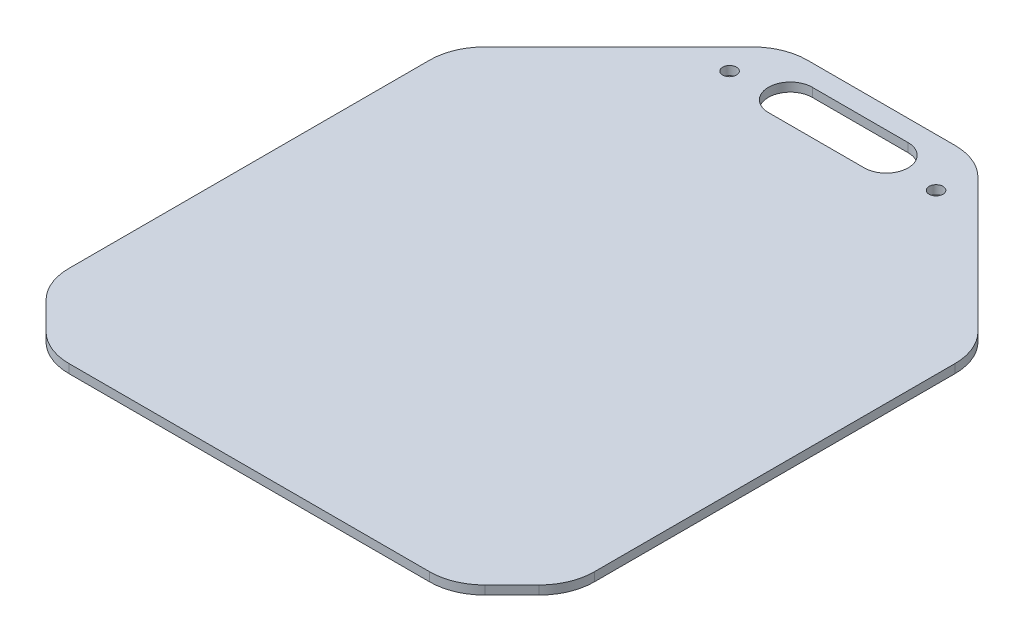
from build123d import *

# Parameters (mm, degrees)
BODY_DEPTH                    = 6.35
HANDLE_DEPTH                  = 6.35
SKETCH11_R                    = 5
LOCKING_MECHANISM_HOLES_DEPTH = 6.36
FILLET1_R                     = 40
FILLET2_R                     = 40
SKETCH12_W                    = 304.8
SKETCH12_H                    = 50.8
BOSS_EXTRUDE1_DEPTH           = 12.7
CUT_EXTRUDE3_DEPTH            = 12.7


with BuildPart() as part:
    # Sketch1 → Body (new body)
    with BuildSketch(Plane(origin=(0, 0, 0), x_dir=(1, 0, 0), z_dir=(0, 1, 0))):
        Polygon((0, 0), (294, 0), (336.996020767, 43.003978862), (336.996020767, 337.003978862), (217, 456.999999629), (77, 456.999999629), (-42.996020767, 337.003978862), (-42.996020767, 43.003978862), align=None)
    extrude(amount=BODY_DEPTH)

    # Sketch2 → Handle (cut)
    with BuildSketch(Plane(origin=(0, 6.35, 0), x_dir=(1, 0, 0), z_dir=(0, 1, 0))):
        with BuildLine():
            Line((112.35, 441.799999629), (181.65, 441.799999629))
            ThreePointArc((181.65, 441.799999629), (197.5, 425.949999629), (181.65, 410.099999629))
            Line((181.65, 410.099999629), (112.35, 410.099999629))
            ThreePointArc((112.35, 410.099999629), (96.5, 425.949999629), (112.35, 441.799999629))
        make_face()
    extrude(amount=-HANDLE_DEPTH, mode=Mode.SUBTRACT)

    # Sketch11 → Locking Mechanism Holes (cut)
    with BuildSketch(Plane(origin=(0, 6.35, 0), x_dir=(1, 0, 0), z_dir=(0, 1, 0))):
        with Locations(Location((221.65, 421.999999629, 0), (0, 0, 270))):
            Circle(SKETCH11_R)
        with Locations(Location((72.35, 421.999999629, 0), (0, 0, 270))):
            Circle(SKETCH11_R)
    extrude(amount=-LOCKING_MECHANISM_HOLES_DEPTH, mode=Mode.SUBTRACT)

    # Fillet1
    fillet1_edges = [part.edges().sort_by_distance(p)[0] for p in [
        (77, 3.175, -456.999999629),
        (217, 3.175, -456.999999629),
    ]]
    fillet(fillet1_edges, radius=FILLET1_R)

    # Fillet2
    fillet2_edges = [part.edges().sort_by_distance(p)[0] for p in [
        (-42.996020767, 3.175, -43.003978862),
        (-42.996020767, 3.175, -337.003978862),
        (336.996020767, 3.175, -337.003978862),
        (336.996020767, 3.175, -43.003978862),
        (294, 3.175, 0),
        (0, 3.175, 0),
    ]]
    fillet(fillet2_edges, radius=FILLET2_R)

    # Sketch12 → Boss-Extrude1 (add)
    with BuildSketch(Plane.XZ):
        with Locations((147, -190.5)):
            Rectangle(SKETCH12_W, SKETCH12_H)
    extrude(amount=BOSS_EXTRUDE1_DEPTH)

    # Sketch13 → Cut-Extrude3 (cut)
    with BuildSketch(Plane.XZ.offset(12.7)):
        with BuildLine():
            Line((261.3, -203.2), (32.7, -203.2))
            ThreePointArc((32.7, -203.2), (20, -190.5), (32.7, -177.8))
            Line((32.7, -177.8), (261.3, -177.8))
            ThreePointArc((261.3, -177.8), (274, -190.5), (261.3, -203.2))
        make_face()
    extrude(amount=-CUT_EXTRUDE3_DEPTH, mode=Mode.SUBTRACT)


solid = part.part
